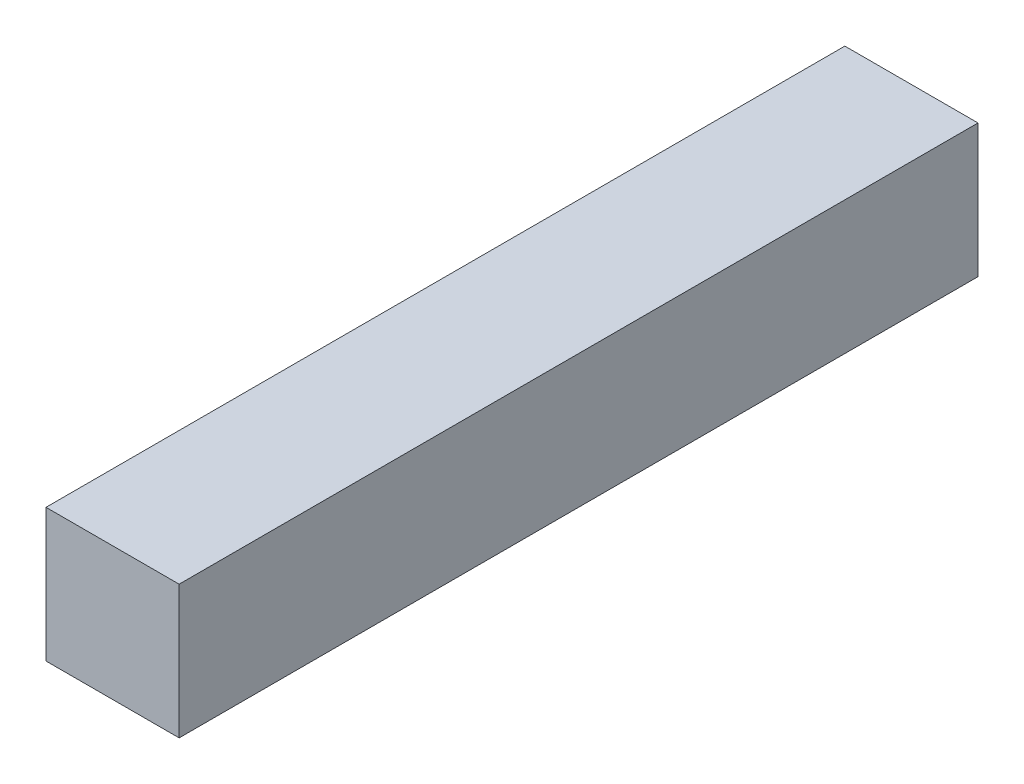
from build123d import *

# Parameters (mm, degrees)
BOSS_EXTRUDE1_DEPTH      = 19.05
BOSS_EXTRUDE1_DEPTH_BACK = 19.05
SKETCH3_W                = 6.35
SKETCH3_H                = 6.35


with BuildPart() as part:
    # Sketch3 → Boss-Extrude1 (new, two sides: drawn at the far end of the back side and taken through both)
    with BuildSketch(Plane.XY.offset(-BOSS_EXTRUDE1_DEPTH_BACK)):
        Rectangle(SKETCH3_W, SKETCH3_H)
    extrude(amount=BOSS_EXTRUDE1_DEPTH + BOSS_EXTRUDE1_DEPTH_BACK)


solid = part.part
